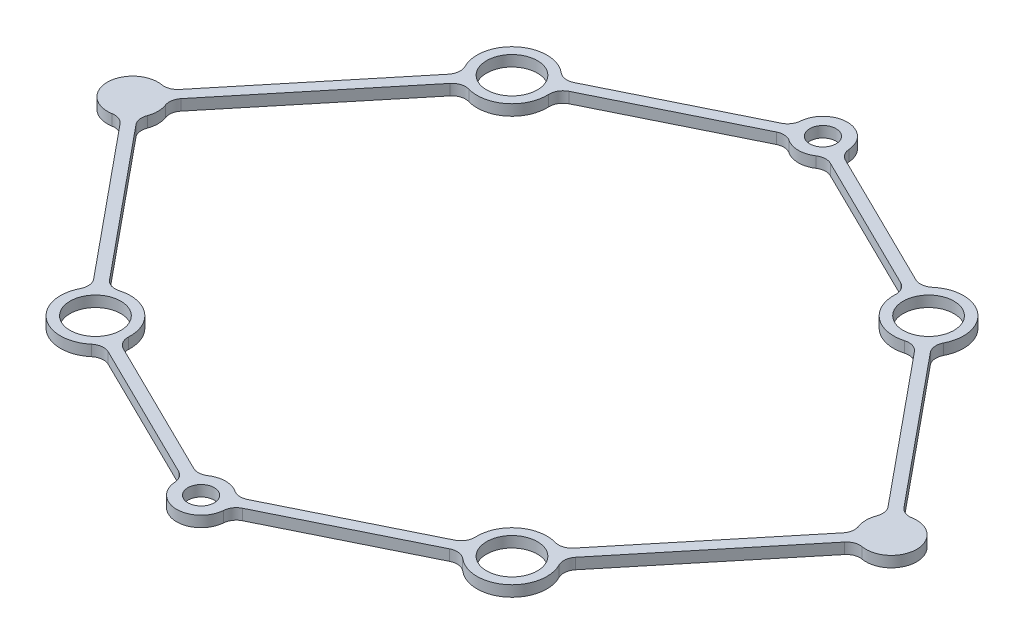
from build123d import *

# Parameters (mm, degrees)
SKETCH1_R           = 3.71
SKETCH1_R_2         = 1.925
BOSS_EXTRUDE1_DEPTH = 1.5875
FILLET1_R           = 2


with BuildPart() as part:
    # Sketch1 → Boss-Extrude1 (new body)
    with BuildSketch(Plane(origin=(0, 0, 0), x_dir=(1, 0, 0), z_dir=(0, 1, 0))):
        with BuildLine():
            Line((-53.793633628, 3.311040487), (-34.282911165, 27.071198303))
            ThreePointArc((-34.282911165, 27.071198303), (-33.620388047, 34.448624702), (-26.285908277, 33.413847594))
            Line((-26.285908277, 33.413847594), (-3.48495612, 44.647688368))
            ThreePointArc((-3.48495612, 44.647688368), (0, 49.02), (3.48495612, 44.647688368))
            Line((3.48495612, 44.647688368), (26.285908277, 33.413847594))
            ThreePointArc((26.285908277, 33.413847594), (33.620388047, 34.448624702), (34.282911165, 27.071198303))
            Line((34.282911165, 27.071198303), (53.793633628, 3.311040487))
            ThreePointArc((53.793633628, 3.311040487), (59.145, 0), (53.793633628, -3.311040487))
            Line((53.793633628, -3.311040487), (34.282911165, -27.071198303))
            ThreePointArc((34.282911165, -27.071198303), (33.620388047, -34.448624702), (26.285908277, -33.413847594))
            Line((26.285908277, -33.413847594), (3.48495612, -44.647688368))
            ThreePointArc((3.48495612, -44.647688368), (0, -49.02), (-3.48495612, -44.647688368))
            Line((-3.48495612, -44.647688368), (-26.285908277, -33.413847594))
            ThreePointArc((-26.285908277, -33.413847594), (-33.620388047, -34.448624702), (-34.282911165, -27.071198303))
            Line((-34.282911165, -27.071198303), (-53.793633628, -3.311040487))
            ThreePointArc((-53.793633628, -3.311040487), (-59.145, 0), (-53.793633628, 3.311040487))
        make_face()
        with Locations(Location((-30.445, 30.445, 0), (0, 0, 270))):
            Circle(SKETCH1_R, mode=Mode.SUBTRACT)
        with Locations(Location((0, -45.445, 0), (0, 0, 90))):
            Circle(SKETCH1_R_2, mode=Mode.SUBTRACT)
        with Locations(Location((-30.445, -30.445, 0), (0, 0, 90))):
            Circle(SKETCH1_R, mode=Mode.SUBTRACT)
        with Locations(Location((0, 45.445, 0), (0, 0, 270))):
            Circle(SKETCH1_R_2, mode=Mode.SUBTRACT)
        with Locations(Location((30.445, -30.445, 0), (0, 0, 270))):
            Circle(SKETCH1_R, mode=Mode.SUBTRACT)
        with Locations(Location((30.445, 30.445, 0), (0, 0, 90))):
            Circle(SKETCH1_R, mode=Mode.SUBTRACT)
        with BuildLine():
            Line((-52.518462907, 2.263930353), (-33.007740444, 26.024088169))
            ThreePointArc((-33.007740444, 26.024088169), (-27.269611953, 26.441375298), (-25.556672132, 31.933741299))
            Line((-25.556672132, 31.933741299), (-2.755719976, 43.167582073))
            ThreePointArc((-2.755719976, 43.167582073), (0, 41.87), (2.755719976, 43.167582073))
            Line((2.755719976, 43.167582073), (25.556672132, 31.933741299))
            ThreePointArc((25.556672132, 31.933741299), (27.269611953, 26.441375298), (33.007740444, 26.024088169))
            Line((33.007740444, 26.024088169), (52.518462907, 2.263930353))
            ThreePointArc((52.518462907, 2.263930353), (51.745, 0), (52.518462907, -2.263930353))
            Line((52.518462907, -2.263930353), (33.007740444, -26.024088169))
            ThreePointArc((33.007740444, -26.024088169), (27.269611953, -26.441375298), (25.556672132, -31.933741299))
            Line((25.556672132, -31.933741299), (2.755719976, -43.167582073))
            ThreePointArc((2.755719976, -43.167582073), (0, -41.87), (-2.755719976, -43.167582073))
            Line((-2.755719976, -43.167582073), (-25.556672132, -31.933741299))
            ThreePointArc((-25.556672132, -31.933741299), (-27.269611953, -26.441375298), (-33.007740444, -26.024088169))
            Line((-33.007740444, -26.024088169), (-52.518462907, -2.263930353))
            ThreePointArc((-52.518462907, -2.263930353), (-51.745, 0), (-52.518462907, 2.263930353))
        make_face(mode=Mode.SUBTRACT)
    extrude(amount=BOSS_EXTRUDE1_DEPTH)

    # Fillet1
    fillet1_edges = [part.edges().sort_by_distance(p)[0] for p in [
        (26.285908277, 0.79375, 33.413847594),
        (3.48495612, 0.79375, 44.647688368),
        (-3.48495612, 0.79375, 44.647688368),
        (-26.285908277, 0.79375, 33.413847594),
        (-34.282911165, 0.79375, 27.071198303),
        (-53.793633628, 0.79375, 3.311040487),
        (-53.793633628, 0.79375, -3.311040487),
        (-34.282911165, 0.79375, -27.071198303),
        (-26.285908277, 0.79375, -33.413847594),
        (-3.48495612, 0.79375, -44.647688368),
        (3.48495612, 0.79375, -44.647688368),
        (26.285908277, 0.79375, -33.413847594),
        (34.282911165, 0.79375, -27.071198303),
        (53.793633628, 0.79375, -3.311040487),
        (53.793633628, 0.79375, 3.311040487),
        (34.282911165, 0.79375, 27.071198303),
        (-52.518462907, 0.79375, -2.263930353),
        (-52.518462907, 0.79375, 2.263930353),
        (-33.007740444, 0.79375, 26.024088169),
        (-25.556672132, 0.79375, 31.933741299),
        (-2.755719976, 0.79375, 43.167582073),
        (2.755719976, 0.79375, 43.167582073),
        (25.556672132, 0.79375, 31.933741299),
        (33.007740444, 0.79375, 26.024088169),
        (52.518462907, 0.79375, 2.263930353),
        (52.518462907, 0.79375, -2.263930353),
        (33.007740444, 0.79375, -26.024088169),
        (25.556672132, 0.79375, -31.933741299),
        (2.755719976, 0.79375, -43.167582073),
        (-2.755719976, 0.79375, -43.167582073),
        (-25.556672132, 0.79375, -31.933741299),
        (-33.007740444, 0.79375, -26.024088169),
    ]]
    fillet(fillet1_edges, radius=FILLET1_R)


solid = part.part
